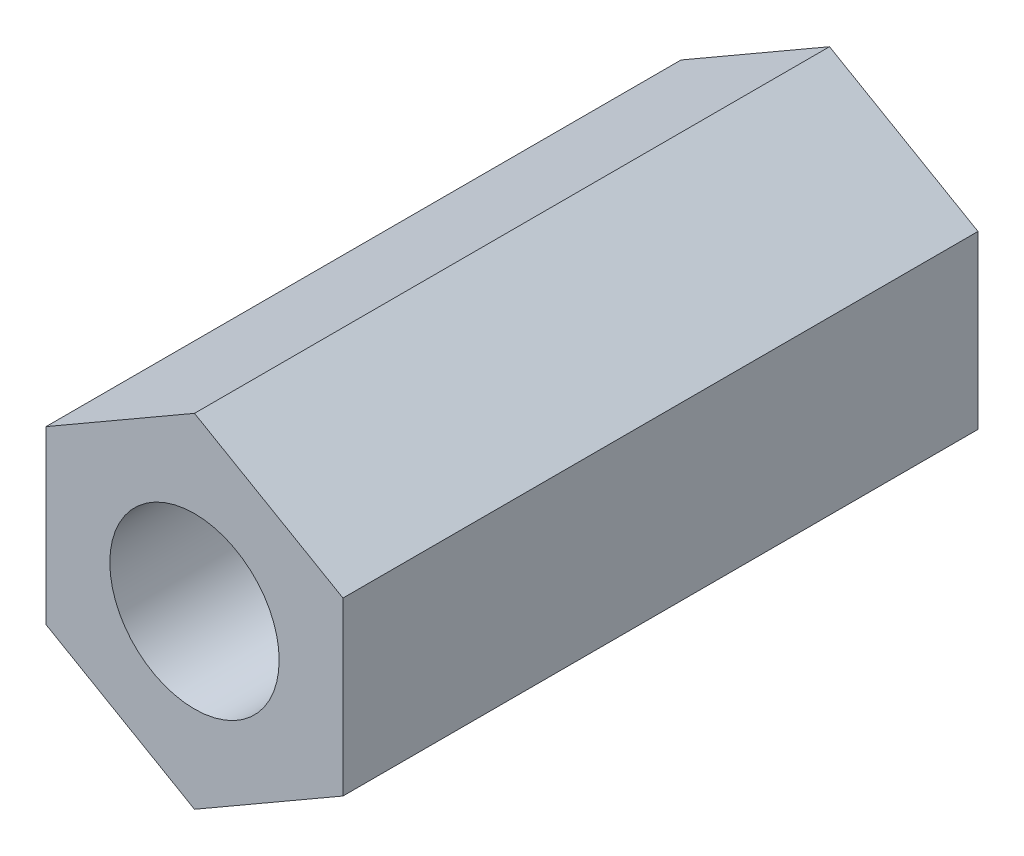
from build123d import *

# Parameters (mm, degrees)
SKETCH_1_R      = 2
EXTRUDE_1_DEPTH = 15


with BuildPart() as part:
    # 草图1 → 凸台-拉伸1 (new body)
    with BuildSketch(Plane.XY):
        Polygon((0, 4.05), (-3.507402885, 2.025), (-3.507402885, -2.025), (0, -4.05), (3.507402885, -2.025), (3.507402885, 2.025), align=None)
        Circle(SKETCH_1_R, mode=Mode.SUBTRACT)
    extrude(amount=EXTRUDE_1_DEPTH)


solid = part.part
